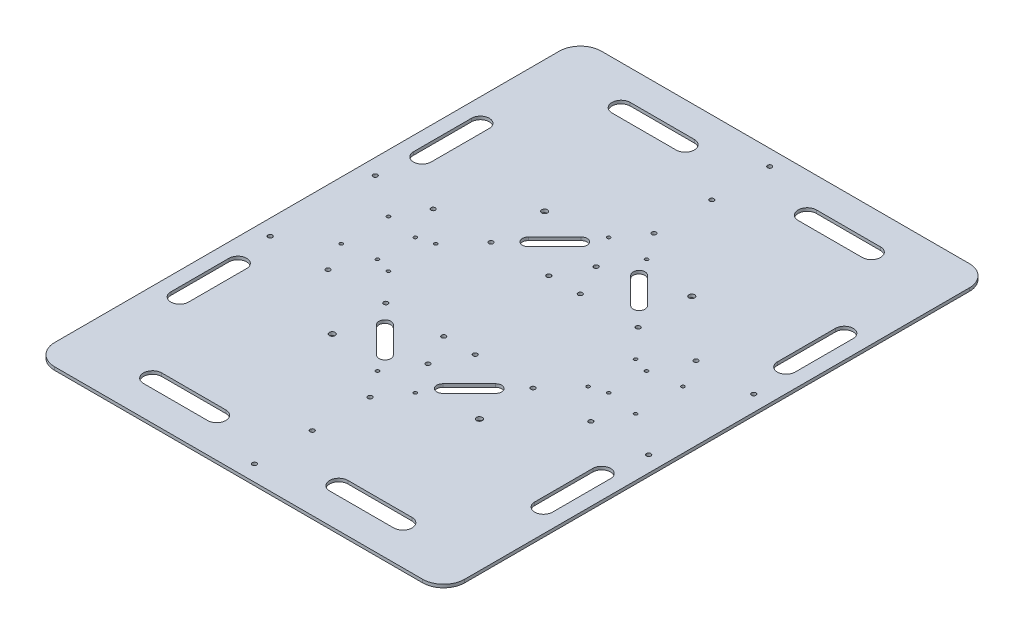
from build123d import *

# Parameters (mm, degrees)
SKETCH_2_W                = 390
SKETCH_2_H                = 520
EXTRUDE_1_DEPTH           = 3
FILLET_1_R                = 20
SKETCH_9_R                = 2.1
CUT_EXTRUDE_3_DEPTH       = 10
PATTERN_LINEAR_3_COUNT    = 4
PATTERN_LINEAR_3_PITCH    = 55
MIRROR_2_COPY_1_SKETCH_R  = 2.1
MIRROR_2_COPY_1_DEPTH     = 10
MIRROR_2_COPY_2_SKETCH_R  = 2.1
MIRROR_2_COPY_2_DEPTH     = 10
MIRROR_2_COPY_3_SKETCH_R  = 2.1
MIRROR_2_COPY_3_DEPTH     = 10
MIRROR_3_COPY_1_SKETCH_R  = 2.1
MIRROR_3_COPY_1_DEPTH     = 10
MIRROR_3_COPY_2_SKETCH_R  = 2.1
MIRROR_3_COPY_2_DEPTH     = 10
MIRROR_3_COPY_3_SKETCH_R  = 2.1
MIRROR_3_COPY_3_DEPTH     = 10
MIRROR_3_COPY_4_SKETCH_R  = 2.1
MIRROR_3_COPY_4_DEPTH     = 10
MIRROR_3_COPY_5_SKETCH_R  = 2.1
MIRROR_3_COPY_5_DEPTH     = 10
MIRROR_3_COPY_6_SKETCH_R  = 2.1
MIRROR_3_COPY_6_DEPTH     = 10
MIRROR_3_COPY_7_SKETCH_R  = 2.1
MIRROR_3_COPY_7_DEPTH     = 10
SKETCH_11_R               = 2.1
CUT_EXTRUDE_4_DEPTH       = 326.013845859
PATTERN_LINEAR_4_COUNT    = 4
PATTERN_LINEAR_4_PITCH    = 55
MIRROR_4_COPY_1_SKETCH_R  = 2.1
MIRROR_4_COPY_1_DEPTH     = 326.013845859
MIRROR_4_COPY_2_SKETCH_R  = 2.1
MIRROR_4_COPY_2_DEPTH     = 326.013845859
MIRROR_4_COPY_3_SKETCH_R  = 2.1
MIRROR_4_COPY_3_DEPTH     = 326.013845859
CUT_EXTRUDE_6_DEPTH       = 326.013845859
MIRROR_11_COPY_1_DEPTH    = 326.013845859
SKETCH_16_R               = 1.6
CUT_EXTRUDE_7_DEPTH       = 326.013845859
PATTERN_LINEAR_5_COUNT    = 2
PATTERN_LINEAR_5_PITCH    = 45
MIRROR_12_COPY_1_SKETCH_R = 1.6
MIRROR_12_COPY_1_DEPTH    = 326.013845859
MIRROR_13_COPY_1_SKETCH_R = 1.6
MIRROR_13_COPY_1_DEPTH    = 326.013845859
MIRROR_13_COPY_2_SKETCH_R = 1.6
MIRROR_13_COPY_2_DEPTH    = 326.013845859
MIRROR_13_COPY_3_SKETCH_R = 1.6
MIRROR_13_COPY_3_DEPTH    = 326.013845859
CUT_EXTRUDE_13_DEPTH      = 10
MIRROR_15_COPY_1_DEPTH    = 10
SKETCH_18_R               = 2.75
CUT_EXTRUDE_14_DEPTH      = 326.013845859
MIRROR_17_COPY_1_SKETCH_R = 2.75
MIRROR_17_COPY_1_DEPTH    = 326.013845859
CUT_EXTRUDE_15_DEPTH      = 326.013845859
MIRROR_19_COPY_1_DEPTH    = 326.013845859
SKETCH_20_R               = 1.6
CUT_EXTRUDE_16_DEPTH      = 326.013845859
MIRROR_21_COPY_1_SKETCH_R = 1.6
MIRROR_21_COPY_1_DEPTH    = 326.013845859
SKETCH_21_R               = 1.6
CUT_EXTRUDE_17_DEPTH      = 326.013845859
MIRROR_23_COPY_1_SKETCH_R = 1.6
MIRROR_23_COPY_1_DEPTH    = 326.013845859


with BuildPart() as part:
    # 草图2 → 凸台-拉伸1 (new body)
    with BuildSketch(Plane(origin=(0, 0, 0), x_dir=(1, 0, 0), z_dir=(0, 1, 0))):
        Rectangle(SKETCH_2_W, SKETCH_2_H)
    extrude(amount=EXTRUDE_1_DEPTH)

    # 圆角1
    fillet_1_edges = [part.edges().sort_by_distance(p)[0] for p in [
        (195, 1.5, 260),
        (-195, 1.5, 260),
        (-195, 1.5, -260),
        (195, 1.5, -260),
    ]]
    fillet(fillet_1_edges, radius=FILLET_1_R)

    # 草图9 → 切除-拉伸3 (cut)
    with BuildSketch(Plane(origin=(0, 3, 0), x_dir=(1, 0, 0), z_dir=(0, 1, 0))):
        with Locations(Location((15, 50, 0), (0, 0, 270))):
            Circle(SKETCH_9_R)
    cut_extrude_3 = extrude(amount=-CUT_EXTRUDE_3_DEPTH, mode=Mode.SUBTRACT)

    # 阵列(线性)3: 切除-拉伸3 ×4
    with Locations(*[(i * PATTERN_LINEAR_3_PITCH, 0, 0) for i in range(1, PATTERN_LINEAR_3_COUNT)]):
        add(cut_extrude_3, mode=Mode.SUBTRACT)

    # 镜向2: 切除-拉伸3 across plane
    add(cut_extrude_3.mirror(Plane(origin=(0, 0, 0), x_dir=(0, 0, 1), z_dir=(1, 0, 0))), mode=Mode.SUBTRACT)

    # 镜向2 copy 1 sketch → 镜向2 copy 1 (cut)
    with BuildSketch(Plane(origin=(-55, 3, 0), x_dir=(-1, 0, 0), z_dir=(0, 1, 0))):
        with Locations((15, -50)):
            Circle(MIRROR_2_COPY_1_SKETCH_R)
    extrude(amount=-MIRROR_2_COPY_1_DEPTH, mode=Mode.SUBTRACT)

    # 镜向2 copy 2 sketch → 镜向2 copy 2 (cut)
    with BuildSketch(Plane(origin=(-110, 3, 0), x_dir=(-1, 0, 0), z_dir=(0, 1, 0))):
        with Locations((15, -50)):
            Circle(MIRROR_2_COPY_2_SKETCH_R)
    extrude(amount=-MIRROR_2_COPY_2_DEPTH, mode=Mode.SUBTRACT)

    # 镜向2 copy 3 sketch → 镜向2 copy 3 (cut)
    with BuildSketch(Plane(origin=(-165, 3, 0), x_dir=(-1, 0, 0), z_dir=(0, 1, 0))):
        with Locations((15, -50)):
            Circle(MIRROR_2_COPY_3_SKETCH_R)
    extrude(amount=-MIRROR_2_COPY_3_DEPTH, mode=Mode.SUBTRACT)

    # 镜向3: 切除-拉伸3 across plane
    add(cut_extrude_3.mirror(Plane(origin=(0, 0, 0), x_dir=(1, 0, 0), z_dir=(0, 0, -1))), mode=Mode.SUBTRACT)

    # 镜向3 copy 1 sketch → 镜向3 copy 1 (cut)
    with BuildSketch(Plane(origin=(55, 3, 0), x_dir=(1, 0, 0), z_dir=(0, 1, 0))):
        with Locations((15, -50)):
            Circle(MIRROR_3_COPY_1_SKETCH_R)
    extrude(amount=-MIRROR_3_COPY_1_DEPTH, mode=Mode.SUBTRACT)

    # 镜向3 copy 2 sketch → 镜向3 copy 2 (cut)
    with BuildSketch(Plane(origin=(110, 3, 0), x_dir=(1, 0, 0), z_dir=(0, 1, 0))):
        with Locations((15, -50)):
            Circle(MIRROR_3_COPY_2_SKETCH_R)
    extrude(amount=-MIRROR_3_COPY_2_DEPTH, mode=Mode.SUBTRACT)

    # 镜向3 copy 3 sketch → 镜向3 copy 3 (cut)
    with BuildSketch(Plane(origin=(165, 3, 0), x_dir=(1, 0, 0), z_dir=(0, 1, 0))):
        with Locations((15, -50)):
            Circle(MIRROR_3_COPY_3_SKETCH_R)
    extrude(amount=-MIRROR_3_COPY_3_DEPTH, mode=Mode.SUBTRACT)

    # 镜向3 copy 4 sketch → 镜向3 copy 4 (cut)
    with BuildSketch(Plane(origin=(0, 3, 0), x_dir=(-1, 0, 0), z_dir=(0, 1, 0))):
        with Locations(Location((15, 50, 0), (0, 0, 270))):
            Circle(MIRROR_3_COPY_4_SKETCH_R)
    extrude(amount=-MIRROR_3_COPY_4_DEPTH, mode=Mode.SUBTRACT)

    # 镜向3 copy 5 sketch → 镜向3 copy 5 (cut)
    with BuildSketch(Plane(origin=(-55, 3, 0), x_dir=(-1, 0, 0), z_dir=(0, 1, 0))):
        with Locations(Location((15, 50, 0), (0, 0, 270))):
            Circle(MIRROR_3_COPY_5_SKETCH_R)
    extrude(amount=-MIRROR_3_COPY_5_DEPTH, mode=Mode.SUBTRACT)

    # 镜向3 copy 6 sketch → 镜向3 copy 6 (cut)
    with BuildSketch(Plane(origin=(-110, 3, 0), x_dir=(-1, 0, 0), z_dir=(0, 1, 0))):
        with Locations(Location((15, 50, 0), (0, 0, 270))):
            Circle(MIRROR_3_COPY_6_SKETCH_R)
    extrude(amount=-MIRROR_3_COPY_6_DEPTH, mode=Mode.SUBTRACT)

    # 镜向3 copy 7 sketch → 镜向3 copy 7 (cut)
    with BuildSketch(Plane(origin=(-165, 3, 0), x_dir=(-1, 0, 0), z_dir=(0, 1, 0))):
        with Locations(Location((15, 50, 0), (0, 0, 270))):
            Circle(MIRROR_3_COPY_7_SKETCH_R)
    extrude(amount=-MIRROR_3_COPY_7_DEPTH, mode=Mode.SUBTRACT)

    # 草图11 → 切除-拉伸4 (cut, through all)
    with BuildSketch(Plane(origin=(0, 3, 0), x_dir=(1, 0, 0), z_dir=(0, 1, 0))):
        with Locations(Location((0.05, -245, 0), (0, 0, 270))):
            Circle(SKETCH_11_R)
    cut_extrude_4 = extrude(amount=-CUT_EXTRUDE_4_DEPTH, mode=Mode.SUBTRACT)

    # 阵列(线性)4: 切除-拉伸4 ×4
    with Locations(*[(0, 0, -i * PATTERN_LINEAR_4_PITCH) for i in range(1, PATTERN_LINEAR_4_COUNT)]):
        add(cut_extrude_4, mode=Mode.SUBTRACT)

    # 镜向4: 切除-拉伸4 across plane
    add(cut_extrude_4.mirror(Plane(origin=(0, 0, 0), x_dir=(1, 0, 0), z_dir=(0, 0, -1))), mode=Mode.SUBTRACT)

    # 镜向4 copy 1 sketch → 镜向4 copy 1 (cut, through all)
    with BuildSketch(Plane(origin=(0, 3, 55), x_dir=(1, 0, 0), z_dir=(0, 1, 0))):
        with Locations((0.05, 245)):
            Circle(MIRROR_4_COPY_1_SKETCH_R)
    extrude(amount=-MIRROR_4_COPY_1_DEPTH, mode=Mode.SUBTRACT)

    # 镜向4 copy 2 sketch → 镜向4 copy 2 (cut, through all)
    with BuildSketch(Plane(origin=(0, 3, 110), x_dir=(1, 0, 0), z_dir=(0, 1, 0))):
        with Locations((0.05, 245)):
            Circle(MIRROR_4_COPY_2_SKETCH_R)
    extrude(amount=-MIRROR_4_COPY_2_DEPTH, mode=Mode.SUBTRACT)

    # 镜向4 copy 3 sketch → 镜向4 copy 3 (cut, through all)
    with BuildSketch(Plane(origin=(0, 3, 165), x_dir=(1, 0, 0), z_dir=(0, 1, 0))):
        with Locations((0.05, 245)):
            Circle(MIRROR_4_COPY_3_SKETCH_R)
    extrude(amount=-MIRROR_4_COPY_3_DEPTH, mode=Mode.SUBTRACT)

    # 草图15 → 切除-拉伸6 (cut, through all)
    with BuildSketch(Plane(origin=(0, 3, 0), x_dir=(1, 0, 0), z_dir=(0, 1, 0))):
        with BuildLine():
            Line((164.639928954, 87.740880958), (164.639928954, 143.005961121))
            ThreePointArc((164.639928954, 143.005961121), (173.068465489, 151.434497656), (181.497002024, 143.005961121))
            Line((181.497002024, 143.005961121), (181.497002024, 87.740880958))
            ThreePointArc((181.497002024, 87.740880958), (173.068465489, 79.312344423), (164.639928954, 87.740880958))
        make_face()
    cut_extrude_6 = extrude(amount=-CUT_EXTRUDE_6_DEPTH, mode=Mode.SUBTRACT)

    # 镜向10: 切除-拉伸6 across plane
    add(cut_extrude_6.mirror(Plane(origin=(0, 0, 0), x_dir=(0, 0, 1), z_dir=(1, 0, 0))), mode=Mode.SUBTRACT)

    # 镜向11: 切除-拉伸6 across plane
    add(cut_extrude_6.mirror(Plane(origin=(0, 0, 0), x_dir=(1, 0, 0), z_dir=(0, 0, -1))), mode=Mode.SUBTRACT)

    # 镜向11 copy 1 sketch → 镜向11 copy 1 (cut, through all)
    with BuildSketch(Plane(origin=(0, 3, 0), x_dir=(-1, 0, 0), z_dir=(0, 1, 0))):
        with BuildLine():
            Line((164.639928954, 87.740880958), (164.639928954, 143.005961121))
            ThreePointArc((164.639928954, 143.005961121), (173.068465489, 151.434497656), (181.497002024, 143.005961121))
            Line((181.497002024, 143.005961121), (181.497002024, 87.740880958))
            ThreePointArc((181.497002024, 87.740880958), (173.068465489, 79.312344423), (164.639928954, 87.740880958))
        make_face()
    extrude(amount=-MIRROR_11_COPY_1_DEPTH, mode=Mode.SUBTRACT)

    # 草图16 → 切除-拉伸7 (cut, through all)
    with BuildSketch(Plane(origin=(0, 3, 0), x_dir=(1, 0, 0), z_dir=(0, 1, 0))):
        with Locations(Location((140, 22.5, 0), (0, 0, 270))):
            Circle(SKETCH_16_R)
    cut_extrude_7 = extrude(amount=-CUT_EXTRUDE_7_DEPTH, mode=Mode.SUBTRACT)

    # 阵列(线性)5: 切除-拉伸7 ×2
    with Locations(*[(-i * PATTERN_LINEAR_5_PITCH, 0, 0) for i in range(1, PATTERN_LINEAR_5_COUNT)]):
        add(cut_extrude_7, mode=Mode.SUBTRACT)

    # 镜向12: 切除-拉伸7 across plane
    add(cut_extrude_7.mirror(Plane(origin=(0, 0, 0), x_dir=(1, 0, 0), z_dir=(0, 0, -1))), mode=Mode.SUBTRACT)

    # 镜向12 copy 1 sketch → 镜向12 copy 1 (cut, through all)
    with BuildSketch(Plane(origin=(-45, 3, 0), x_dir=(1, 0, 0), z_dir=(0, 1, 0))):
        with Locations((140, -22.5)):
            Circle(MIRROR_12_COPY_1_SKETCH_R)
    extrude(amount=-MIRROR_12_COPY_1_DEPTH, mode=Mode.SUBTRACT)

    # 镜向13: 切除-拉伸7 across plane
    add(cut_extrude_7.mirror(Plane(origin=(0, 0, 0), x_dir=(0, 0, 1), z_dir=(1, 0, 0))), mode=Mode.SUBTRACT)

    # 镜向13 copy 1 sketch → 镜向13 copy 1 (cut, through all)
    with BuildSketch(Plane(origin=(45, 3, 0), x_dir=(-1, 0, 0), z_dir=(0, 1, 0))):
        with Locations((140, -22.5)):
            Circle(MIRROR_13_COPY_1_SKETCH_R)
    extrude(amount=-MIRROR_13_COPY_1_DEPTH, mode=Mode.SUBTRACT)

    # 镜向13 copy 2 sketch → 镜向13 copy 2 (cut, through all)
    with BuildSketch(Plane(origin=(0, 3, 0), x_dir=(-1, 0, 0), z_dir=(0, 1, 0))):
        with Locations(Location((140, 22.5, 0), (0, 0, 270))):
            Circle(MIRROR_13_COPY_2_SKETCH_R)
    extrude(amount=-MIRROR_13_COPY_2_DEPTH, mode=Mode.SUBTRACT)

    # 镜向13 copy 3 sketch → 镜向13 copy 3 (cut, through all)
    with BuildSketch(Plane(origin=(45, 3, 0), x_dir=(-1, 0, 0), z_dir=(0, 1, 0))):
        with Locations(Location((140, 22.5, 0), (0, 0, 270))):
            Circle(MIRROR_13_COPY_3_SKETCH_R)
    extrude(amount=-MIRROR_13_COPY_3_DEPTH, mode=Mode.SUBTRACT)

    # 草图17 → 切除-拉伸13 (cut)
    with BuildSketch(Plane(origin=(0, 3, 0), x_dir=(1, 0, 0), z_dir=(0, 1, 0))):
        with BuildLine():
            Line((31.504298158, 97.342807331), (56.651683754, 72.195421735))
            ThreePointArc((56.651683754, 72.195421735), (56.651683754, 64.227183811), (48.68344583, 64.227183811))
            Line((48.68344583, 64.227183811), (23.536060234, 89.374569407))
            ThreePointArc((23.536060234, 89.374569407), (23.536060234, 97.342807331), (31.504298158, 97.342807331))
        make_face()
    cut_extrude_13 = extrude(amount=-CUT_EXTRUDE_13_DEPTH, mode=Mode.SUBTRACT)

    # 镜向14: 切除-拉伸13 across plane
    add(cut_extrude_13.mirror(Plane(origin=(0, 0, 0), x_dir=(1, 0, 0), z_dir=(0, 0, -1))), mode=Mode.SUBTRACT)

    # 镜向15: 切除-拉伸13 across plane
    add(cut_extrude_13.mirror(Plane(origin=(0, 0, 0), x_dir=(0, 0, 1), z_dir=(1, 0, 0))), mode=Mode.SUBTRACT)

    # 镜向15 copy 1 sketch → 镜向15 copy 1 (cut)
    with BuildSketch(Plane(origin=(0, 3, 0), x_dir=(-1, 0, 0), z_dir=(0, 1, 0))):
        with BuildLine():
            Line((31.504298158, 97.342807331), (56.651683754, 72.195421735))
            ThreePointArc((56.651683754, 72.195421735), (56.651683754, 64.227183811), (48.68344583, 64.227183811))
            Line((48.68344583, 64.227183811), (23.536060234, 89.374569407))
            ThreePointArc((23.536060234, 89.374569407), (23.536060234, 97.342807331), (31.504298158, 97.342807331))
        make_face()
    extrude(amount=-MIRROR_15_COPY_1_DEPTH, mode=Mode.SUBTRACT)

    # 草图18 → 切除-拉伸14 (cut, through all)
    with BuildSketch(Plane(origin=(0, 3, 0), x_dir=(1, 0, 0), z_dir=(0, 1, 0))):
        with Locations(Location((-70, 101, 0), (0, 0, 270))):
            Circle(SKETCH_18_R)
    cut_extrude_14 = extrude(amount=-CUT_EXTRUDE_14_DEPTH, mode=Mode.SUBTRACT)

    # 镜向16: 切除-拉伸14 across plane
    add(cut_extrude_14.mirror(Plane(origin=(0, 0, 0), x_dir=(1, 0, 0), z_dir=(0, 0, -1))), mode=Mode.SUBTRACT)

    # 镜向17: 切除-拉伸14 across plane
    add(cut_extrude_14.mirror(Plane(origin=(0, 0, 0), x_dir=(0, 0, 1), z_dir=(1, 0, 0))), mode=Mode.SUBTRACT)

    # 镜向17 copy 1 sketch → 镜向17 copy 1 (cut, through all)
    with BuildSketch(Plane(origin=(0, 3, 0), x_dir=(-1, 0, 0), z_dir=(0, 1, 0))):
        with Locations(Location((-70, 101, 0), (0, 0, 270))):
            Circle(MIRROR_17_COPY_1_SKETCH_R)
    extrude(amount=-MIRROR_17_COPY_1_DEPTH, mode=Mode.SUBTRACT)

    # 草图19 → 切除-拉伸15 (cut, through all)
    with BuildSketch(Plane(origin=(0, 3, 0), x_dir=(1, 0, 0), z_dir=(0, 1, 0))):
        with BuildLine():
            Line((119.033986781, -231.502066126), (58.059204776, -231.502066126))
            ThreePointArc((58.059204776, -231.502066126), (49.362812435, -222.805673785), (58.059204776, -214.109281444))
            Line((58.059204776, -214.109281444), (119.033986781, -214.109281444))
            ThreePointArc((119.033986781, -214.109281444), (127.730379122, -222.805673785), (119.033986781, -231.502066126))
        make_face()
    cut_extrude_15 = extrude(amount=-CUT_EXTRUDE_15_DEPTH, mode=Mode.SUBTRACT)

    # 镜向18: 切除-拉伸15 across plane
    add(cut_extrude_15.mirror(Plane(origin=(0, 0, 0), x_dir=(0, 0, 1), z_dir=(1, 0, 0))), mode=Mode.SUBTRACT)

    # 镜向19: 切除-拉伸15 across plane
    add(cut_extrude_15.mirror(Plane(origin=(0, 0, 0), x_dir=(1, 0, 0), z_dir=(0, 0, -1))), mode=Mode.SUBTRACT)

    # 镜向19 copy 1 sketch → 镜向19 copy 1 (cut, through all)
    with BuildSketch(Plane(origin=(0, 3, 0), x_dir=(-1, 0, 0), z_dir=(0, 1, 0))):
        with BuildLine():
            Line((119.033986781, -231.502066126), (58.059204776, -231.502066126))
            ThreePointArc((58.059204776, -231.502066126), (49.362812435, -222.805673785), (58.059204776, -214.109281444))
            Line((58.059204776, -214.109281444), (119.033986781, -214.109281444))
            ThreePointArc((119.033986781, -214.109281444), (127.730379122, -222.805673785), (119.033986781, -231.502066126))
        make_face()
    extrude(amount=-MIRROR_19_COPY_1_DEPTH, mode=Mode.SUBTRACT)

    # 草图20 → 切除-拉伸16 (cut, through all)
    with BuildSketch(Plane.XZ):
        with Locations(Location((-18, -110, 0), (0, 0, 270))):
            Circle(SKETCH_20_R)
    cut_extrude_16 = extrude(amount=-CUT_EXTRUDE_16_DEPTH, mode=Mode.SUBTRACT)

    # 镜向20: 切除-拉伸16 across plane
    add(cut_extrude_16.mirror(Plane(origin=(0, 0, 0), x_dir=(0, 0, 1), z_dir=(1, 0, 0))), mode=Mode.SUBTRACT)

    # 镜向21: 切除-拉伸16 across plane
    add(cut_extrude_16.mirror(Plane(origin=(0, 0, 0), x_dir=(1, 0, 0), z_dir=(0, 0, -1))), mode=Mode.SUBTRACT)

    # 镜向21 copy 1 sketch → 镜向21 copy 1 (cut, through all)
    with BuildSketch(Plane(origin=(0, 0, 0), x_dir=(-1, 0, 0), z_dir=(0, -1, 0))):
        with Locations(Location((-18, -110, 0), (0, 0, 270))):
            Circle(MIRROR_21_COPY_1_SKETCH_R)
    extrude(amount=-MIRROR_21_COPY_1_DEPTH, mode=Mode.SUBTRACT)

    # 草图21 → 切除-拉伸17 (cut, through all)
    with BuildSketch(Plane(origin=(0, 0, 0), x_dir=(-1, 0, 0), z_dir=(0, -1, 0))):
        with Locations(Location((110, 18, 0), (0, 0, 90))):
            Circle(SKETCH_21_R)
    cut_extrude_17 = extrude(amount=-CUT_EXTRUDE_17_DEPTH, mode=Mode.SUBTRACT)

    # 镜向22: 切除-拉伸17 across plane
    add(cut_extrude_17.mirror(Plane(origin=(0, 0, 0), x_dir=(1, 0, 0), z_dir=(0, 0, -1))), mode=Mode.SUBTRACT)

    # 镜向23: 切除-拉伸17 across plane
    add(cut_extrude_17.mirror(Plane(origin=(0, 0, 0), x_dir=(0, 0, 1), z_dir=(1, 0, 0))), mode=Mode.SUBTRACT)

    # 镜向23 copy 1 sketch → 镜向23 copy 1 (cut, through all)
    with BuildSketch(Plane.XZ):
        with Locations(Location((110, 18, 0), (0, 0, 90))):
            Circle(MIRROR_23_COPY_1_SKETCH_R)
    extrude(amount=-MIRROR_23_COPY_1_DEPTH, mode=Mode.SUBTRACT)


solid = part.part
